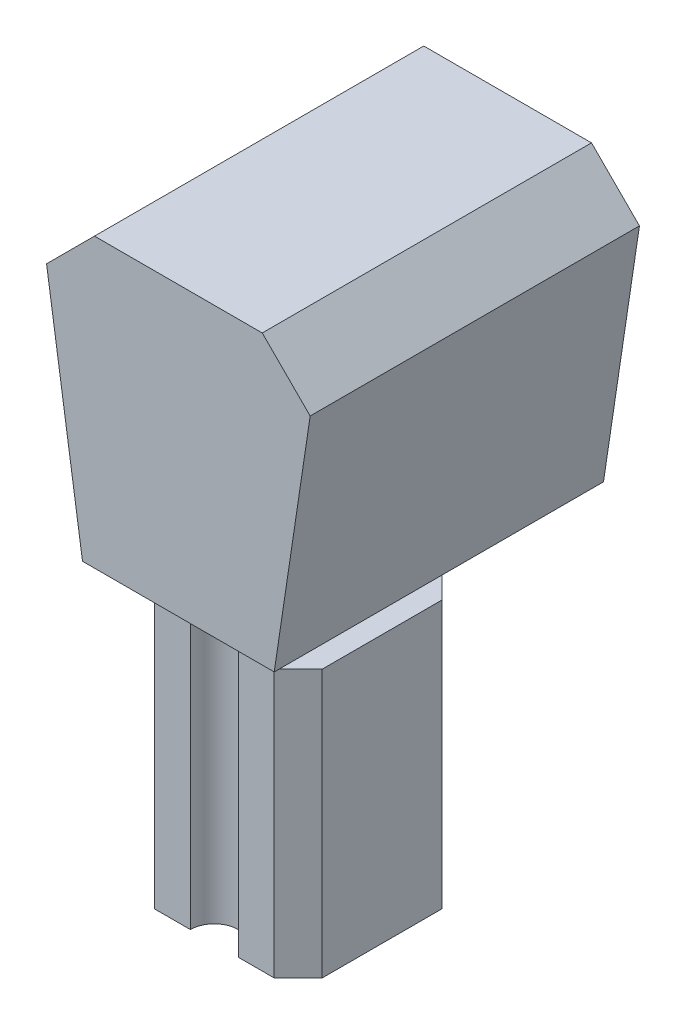
from build123d import *

# Parameters (mm, degrees)
RESSALTO_EXTRUS_O1_DEPTH = 687
RESSALTO_EXTRUS_O2_DEPTH = 558


with BuildPart() as part:
    # Esboço6 → Ressalto-extrusão1 (new body)
    with BuildSketch(Plane.XY):
        Polygon((-200, 70), (200, 70), (275, 570), (175, 670), (-175, 670), (-275, 570), align=None)
    extrude(amount=-RESSALTO_EXTRUS_O1_DEPTH)


with BuildPart() as body_2:
    # Esboço10 → Ressalto-extrusão2 (new body)
    with BuildSketch(Plane(origin=(0, 0, 0), x_dir=(1, 0, 0), z_dir=(0, 1, 0))):
        with BuildLine():
            Line((-175, 375), (-125, 425))
            Line((-125, 425), (-50, 425))
            ThreePointArc((-50, 425), (0, 375), (50, 425))
            Line((50, 425), (125, 425))
            Line((125, 425), (175, 375))
            Line((175, 375), (175, 125))
            Line((175, 125), (125, 75))
            Line((125, 75), (50, 75))
            ThreePointArc((50, 75), (0, 125), (-50, 75))
            Line((-50, 75), (-125, 75))
            Line((-125, 75), (-175, 125))
            Line((-175, 125), (-175, 375))
        make_face()
    extrude(amount=-RESSALTO_EXTRUS_O2_DEPTH)


solid = Compound([part.part, body_2.part])
